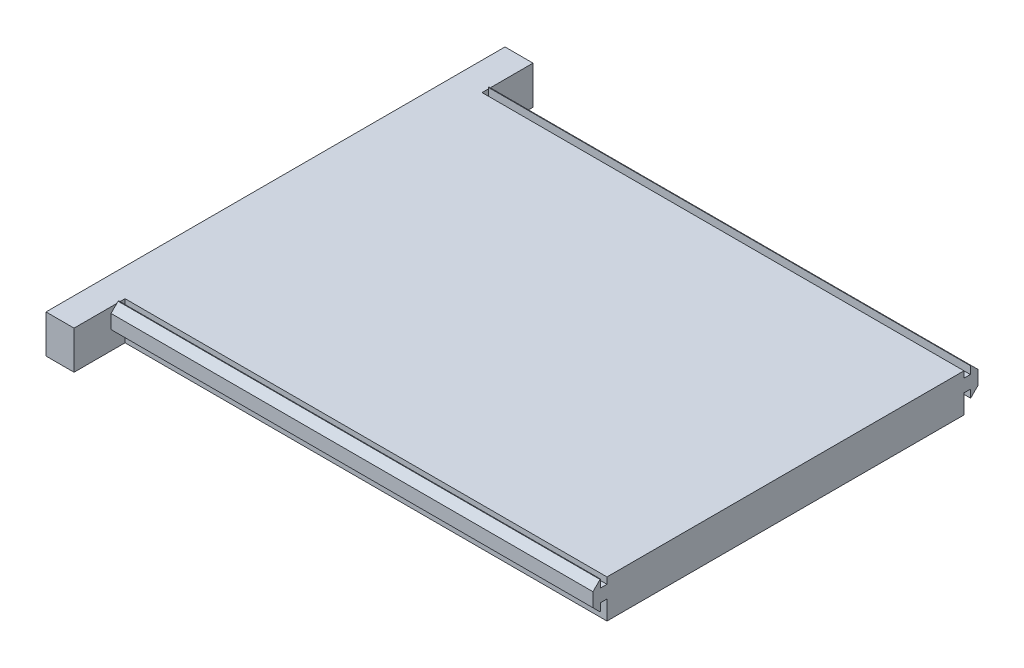
from build123d import *

# Parameters (mm, degrees)
SKETCH1_R           = 2.1
BOSS_EXTRUDE1_DEPTH = 65
BOSS_EXTRUDE6_DEPTH = 200
SKETCH85_W          = 34.906324044
SKETCH85_H          = 40.252337635
CUT_EXTRUDE59_DEPTH = 65
SKETCH87_W          = 20
SKETCH87_H          = 15
BOSS_EXTRUDE7_DEPTH = 11
SKETCH88_W          = 1.985779144
SKETCH88_H          = 1.348664344
SKETCH88_W_2        = 1.884447459
SKETCH88_H_2        = 1.174834559
CUT_EXTRUDE60_DEPTH = 11
CUT_EXTRUDE61_DEPTH = 189


with BuildPart() as part:
    # Sketch1 → Boss-Extrude1 (new body)
    with BuildSketch(Plane(origin=(0, 0, 0), x_dir=(0, 0, -1), z_dir=(1, 0, 0))):
        with BuildLine():
            Line((-10, 9), (-10, 3))
            Line((-10, 3), (-8, 3))
            Line((-8, 3), (-8, 6))
            Line((-8, 6), (-7.060660172, 6))
            Line((-7.060660172, 6), (-4, 2.939339828))
            Line((-4, 2.939339828), (-4, -2.939339828))
            Line((-4, -2.939339828), (-7.060660172, -6))
            Line((-7.060660172, -6), (-8, -6))
            Line((-8, -6), (-8, -3))
            Line((-8, -3), (-10, -3))
            Line((-10, -3), (-10, -9))
            ThreePointArc((-10, -9), (-9.707106781, -9.707106781), (-9, -10))
            Line((-9, -10), (-3, -10))
            Line((-3, -10), (-3, -8))
            Line((-3, -8), (-6, -8))
            Line((-6, -8), (-6, -7.060660172))
            Line((-6, -7.060660172), (-2.939339828, -4))
            Line((-2.939339828, -4), (2.939339828, -4))
            Line((2.939339828, -4), (6, -7.060660172))
            Line((6, -7.060660172), (6, -8))
            Line((6, -8), (3, -8))
            Line((3, -8), (3, -10))
            Line((3, -10), (9, -10))
            ThreePointArc((9, -10), (9.707106781, -9.707106781), (10, -9))
            Line((10, -9), (10, -3))
            Line((10, -3), (8, -3))
            Line((8, -3), (8, -6))
            Line((8, -6), (7.060660172, -6))
            Line((7.060660172, -6), (4, -2.939339828))
            Line((4, -2.939339828), (4, 2.939339828))
            Line((4, 2.939339828), (7.060660172, 6))
            Line((7.060660172, 6), (8, 6))
            Line((8, 6), (8, 3))
            Line((8, 3), (10, 3))
            Line((10, 3), (10, 9))
            ThreePointArc((10, 9), (9.707106781, 9.707106781), (9, 10))
            Line((9, 10), (3, 10))
            Line((3, 10), (3, 8))
            Line((3, 8), (6, 8))
            Line((6, 8), (6, 7.060660172))
            Line((6, 7.060660172), (2.939339828, 4))
            Line((2.939339828, 4), (-2.939339828, 4))
            Line((-2.939339828, 4), (-6, 7.060660172))
            Line((-6, 7.060660172), (-6, 8))
            Line((-6, 8), (-3, 8))
            Line((-3, 8), (-3, 10))
            Line((-3, 10), (-9, 10))
            ThreePointArc((-9, 10), (-9.707106781, 9.707106781), (-10, 9))
        make_face()
        Circle(SKETCH1_R, mode=Mode.SUBTRACT)
    extrude(amount=BOSS_EXTRUDE1_DEPTH)

    # Sketch85 → Cut-Extrude59 (cut)
    with BuildSketch(Plane.ZY):
        with Locations((-1.630437185, 0.066948306)):
            Rectangle(SKETCH85_W, SKETCH85_H)
    extrude(amount=-CUT_EXTRUDE59_DEPTH, mode=Mode.SUBTRACT)


with BuildPart() as body_2:
    # Sketch84 → Boss-Extrude6 (new body)
    with BuildSketch(Plane(origin=(65, 0, 0), x_dir=(0, 0, -1), z_dir=(1, 0, 0))):
        Polygon((-150, -2.9), (-150, 2.9), (-152.1, 2.9), (-152.1, 5.9), (-152.897918472, 5.9), (-155.9, 2.897918472), (-155.9, -2.897918472), (-152.897918472, -5.9), (-152.1, -5.9), (-152.1, -2.9), align=None)
        Polygon((-80, -10), (-80, 5), (-150, 5), (-150, 3), (-150, 2.9), (-150, -2.9), (-150, -3), (-150, -10), align=None)
        Polygon((-10, 2.9), (-10, 3), (-10, 5), (-80, 5), (-80, -10), (-10, -10), (-10, -9), (-10, -3), (-10, -2.9), (-7.9, -2.9), (-7.9, -5.9), (-7.102081528, -5.9), (-4.1, -2.897918472), (-4.1, 2.897918472), (-7.102081528, 5.9), (-7.9, 5.9), (-7.9, 2.9), align=None)
    extrude(amount=BOSS_EXTRUDE6_DEPTH)

    # Sketch87 → Boss-Extrude7 (add)
    with BuildSketch(Plane.ZY.offset(-65)):
        with Locations((160, -2.5)):
            Rectangle(SKETCH87_W, SKETCH87_H)
        with Locations((0, -2.5)):
            Rectangle(SKETCH87_W, SKETCH87_H)
    extrude(amount=-BOSS_EXTRUDE7_DEPTH)

    # Sketch88 → Cut-Extrude60 (cut)
    with BuildSketch(Plane.ZY.offset(-65)):
        with Locations((153.092889572, 5.674332172)):
            Rectangle(SKETCH88_W, SKETCH88_H)
        with Locations((6.957776271, 5.58741728)):
            Rectangle(SKETCH88_W_2, SKETCH88_H_2)
    extrude(amount=-CUT_EXTRUDE60_DEPTH, mode=Mode.SUBTRACT)

    # Sketch89 → Cut-Extrude61 (cut)
    with BuildSketch(Plane(origin=(265, 0, 0), x_dir=(0, 0, -1), z_dir=(1, 0, 0))):
        Polygon((-7.9, 2.9), (-10, 2.9), (-10, 2.5), (-9.6, 2.5), (-7.5, 2.5), (-7.5, 5.5), (-7.267766953, 5.5), (-4.5, 2.732233047), (-4.5, -2.732233047), (-7.267766953, -5.5), (-7.5, -5.5), (-7.5, -2.5), (-9.6, -2.5), (-10, -2.5), (-10, -2.9), (-7.9, -2.9), (-7.9, -5.9), (-7.102081528, -5.9), (-4.1, -2.897918472), (-4.1, 2.897918472), (-7.102081528, 5.9), (-7.9, 5.9), align=None)
        Polygon((-150, 2.5), (-150, 2.9), (-152.1, 2.9), (-152.1, 5.9), (-152.897918472, 5.9), (-155.9, 2.897918472), (-155.9, -2.897918472), (-152.897918472, -5.9), (-152.1, -5.9), (-152.1, -2.9), (-150, -2.9), (-150, -2.5), (-150.4, -2.5), (-152.5, -2.5), (-152.5, -5.5), (-152.732233047, -5.5), (-155.5, -2.732233047), (-155.5, 2.732233047), (-152.732233047, 5.5), (-152.5, 5.5), (-152.5, 2.5), (-150.4, 2.5), align=None)
    extrude(amount=-CUT_EXTRUDE61_DEPTH, mode=Mode.SUBTRACT)


solid = body_2.part
